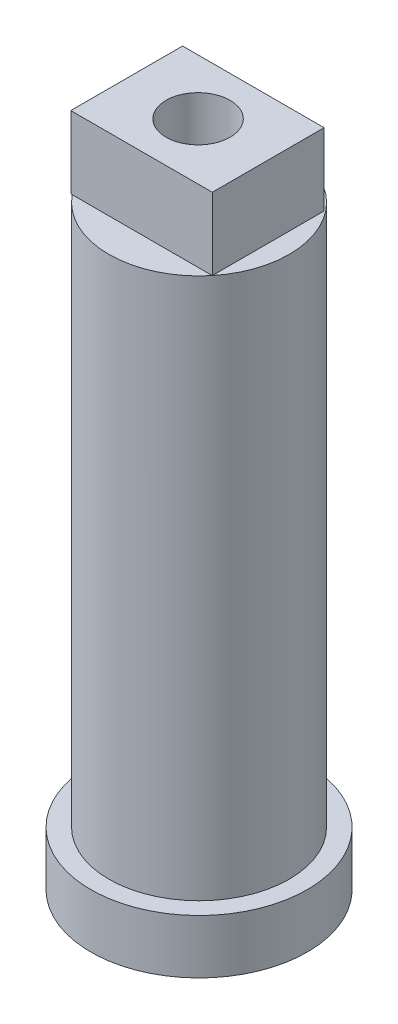
from build123d import *

# Parameters (mm, degrees)
SKETCH1_R           = 5
BOSS_EXTRUDE2_DEPTH = 30
SKETCH2_W           = 7.845289229
SKETCH2_H           = 6.199593877
BOSS_EXTRUDE3_DEPTH = 4
SKETCH3_R           = 1.774695969
CUT_EXTRUDE1_DEPTH  = 3
SKETCH4_R           = 6
BOSS_EXTRUDE4_DEPTH = 3


with BuildPart() as part:
    # Sketch1 → Boss-Extrude2 (new body)
    with BuildSketch(Plane(origin=(0, 0, 0), x_dir=(1, 0, 0), z_dir=(0, 1, 0))):
        with Locations(Location((-2.376457655, 3.696711907, 0), (0, 0, 270))):
            Circle(SKETCH1_R)
    extrude(amount=BOSS_EXTRUDE2_DEPTH)

    # Sketch2 → Boss-Extrude3 (add)
    with BuildSketch(Plane(origin=(0, 30, 0), x_dir=(1, 0, 0), z_dir=(0, 1, 0))):
        with Locations((-2.416245544, 3.646362238)):
            Rectangle(SKETCH2_W, SKETCH2_H)
    extrude(amount=BOSS_EXTRUDE3_DEPTH)

    # Sketch3 → Cut-Extrude1 (cut)
    with BuildSketch(Plane(origin=(0, 34, 0), x_dir=(1, 0, 0), z_dir=(0, 1, 0))):
        with Locations(Location((-2.415547682, 3.681180673, 0), (0, 0, 270))):
            Circle(SKETCH3_R)
    extrude(amount=-CUT_EXTRUDE1_DEPTH, mode=Mode.SUBTRACT)

    # Sketch4 → Boss-Extrude4 (add)
    with BuildSketch(Plane(origin=(0, 0, 0), x_dir=(-1, 0, 0), z_dir=(0, -1, 0))):
        with Locations(Location((2.376457655, 3.696711907, 0), (0, 0, 90))):
            Circle(SKETCH4_R)
    extrude(amount=BOSS_EXTRUDE4_DEPTH)


solid = part.part
